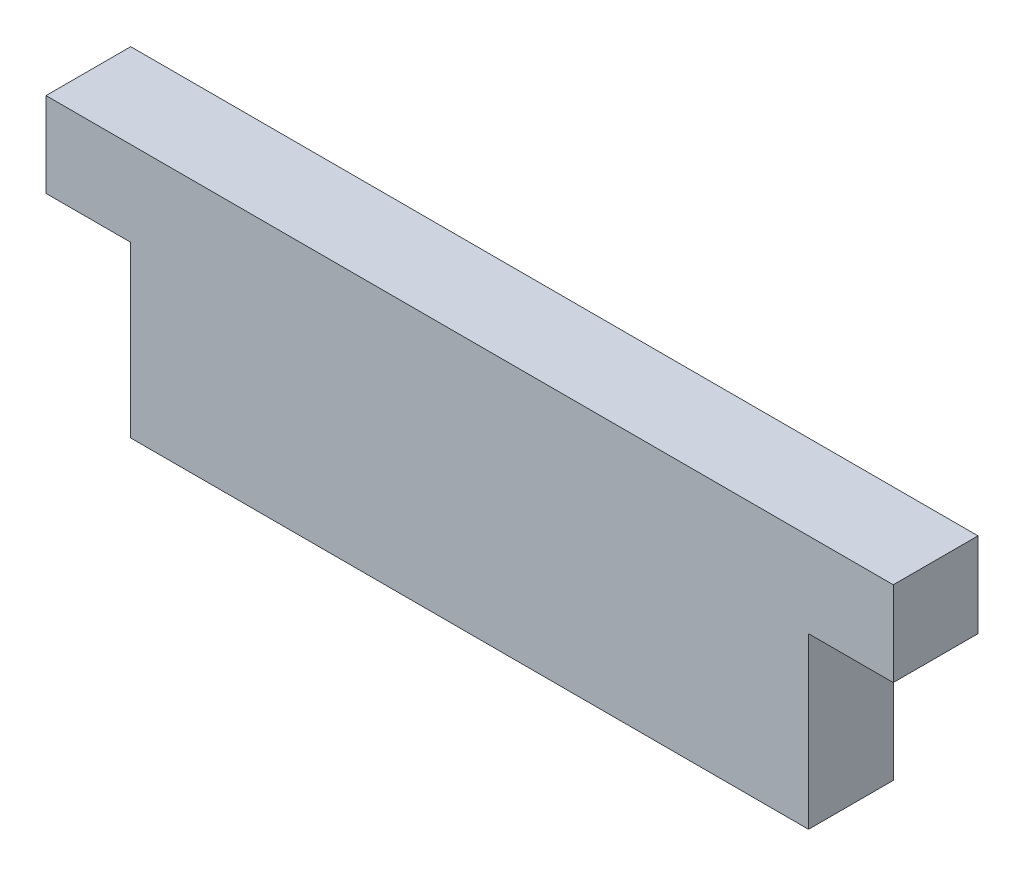
from build123d import *

# Parameters (mm, degrees)
SKETCH1_W           = 40
SKETCH1_H           = 10
BOSS_EXTRUDE1_DEPTH = 5


with BuildPart() as part:
    # Sketch1 → Boss-Extrude1 (new body)
    with BuildSketch(Plane.XY):
        with Locations((-20, -5)):
            Rectangle(SKETCH1_W, SKETCH1_H)
        Polygon((-40, 0), (0, 0), (5, 0), (5, 5), (-45, 5), (-45, 0), align=None)
    extrude(amount=BOSS_EXTRUDE1_DEPTH)


solid = part.part
